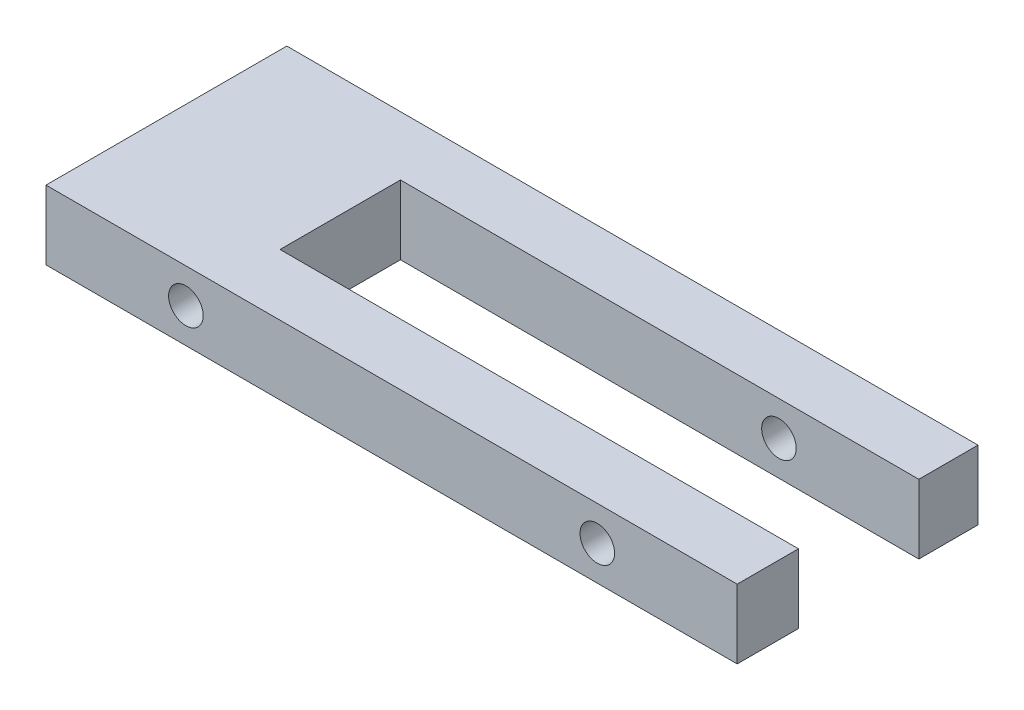
from build123d import *

# Parameters (mm, degrees)
BOSS_EXTRUDE1_DEPTH = 100
CUT_EXTRUDE1_REACH  = 619.562
SKETCH8_R           = 25


with BuildPart() as part:
    # Sketch5 → Boss-Extrude1 (new body)
    with BuildSketch(Plane(origin=(0, 0, 0), x_dir=(-1, 0, 0), z_dir=(0, -1, 0))):
        Polygon((-500, 171.192494481), (500, 171.192494481), (500, -177.207505519), (-500, -177.207505519), (-500, -88.603752759), (250, -88.603752759), (250, 85.596247241), (-500, 85.596247241), align=None)
    extrude(amount=BOSS_EXTRUDE1_DEPTH)

    # Cut-Extrude1: up to this face of the body (flat: up to its plane)
    cut_extrude1_end = Plane(part.part.faces().sort_by_distance((0, -50, 177.207505519))[0])
    # Sketch8 → Cut-Extrude1 (cut, up to the picked face)
    with BuildSketch(Plane(origin=(0, 0, -171.192494481), x_dir=(-1, 0, 0), z_dir=(0, 0, -1)), mode=Mode.PRIVATE) as cut_extrude1_sk1:
        with Locations((-297.6, -50)):
            Circle(SKETCH8_R)
    cut_extrude1_tool1 = split(extrude(cut_extrude1_sk1.sketch, amount=-CUT_EXTRUDE1_REACH, mode=Mode.PRIVATE), bisect_by=cut_extrude1_end, keep=Keep.BOTH, mode=Mode.PRIVATE)
    # Sketch8 → Cut-Extrude1 (cut, up to the picked face)
    with BuildSketch(Plane(origin=(0, 0, -171.192494481), x_dir=(-1, 0, 0), z_dir=(0, 0, -1)), mode=Mode.PRIVATE) as cut_extrude1_sk2:
        with Locations((297.6, -50)):
            Circle(SKETCH8_R)
    cut_extrude1_tool2 = split(extrude(cut_extrude1_sk2.sketch, amount=-CUT_EXTRUDE1_REACH, mode=Mode.PRIVATE), bisect_by=cut_extrude1_end, keep=Keep.BOTH, mode=Mode.PRIVATE)
    add(cut_extrude1_tool1.solids().sort_by(Axis((297.6, -50, -171.192494), (0, 0, 1)))[0], mode=Mode.SUBTRACT)
    add(cut_extrude1_tool2.solids().sort_by(Axis((-297.6, -50, -171.192494), (0, 0, 1)))[0], mode=Mode.SUBTRACT)


solid = part.part
